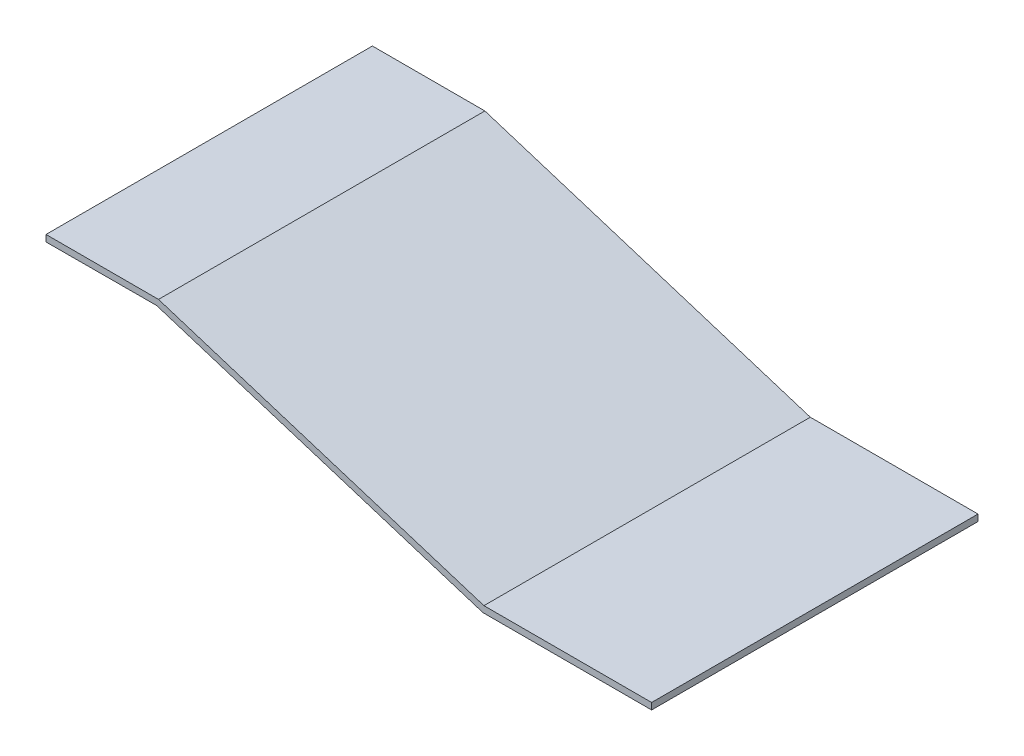
from build123d import *

# Parameters (mm, degrees)
BOSS_EXTRUDE1_DEPTH = 1000


with BuildPart() as part:
    # Sketch1 → Boss-Extrude1 (new body)
    with BuildSketch(Plane.XY):
        Polygon((0, 76.661083739), (0, 56.661083739), (338.719471809, 57.585110825), (1338.719471809, -257.414889175), (1338.719471809, -237.414889175), (1341.794983957, -237.414889175), (344.728403277, 76.661083739), align=None)
        Polygon((1338.719471809, -237.414889175), (1338.719471809, -257.414889175), (1405.287047449, -257.414889175), (1341.794983957, -237.414889175), align=None)
        Polygon((1855.588314329, -237.414889175), (1341.794983957, -237.414889175), (1405.287047449, -257.414889175), (1855.588314329, -257.414889175), align=None)
    extrude(amount=BOSS_EXTRUDE1_DEPTH)


solid = part.part
